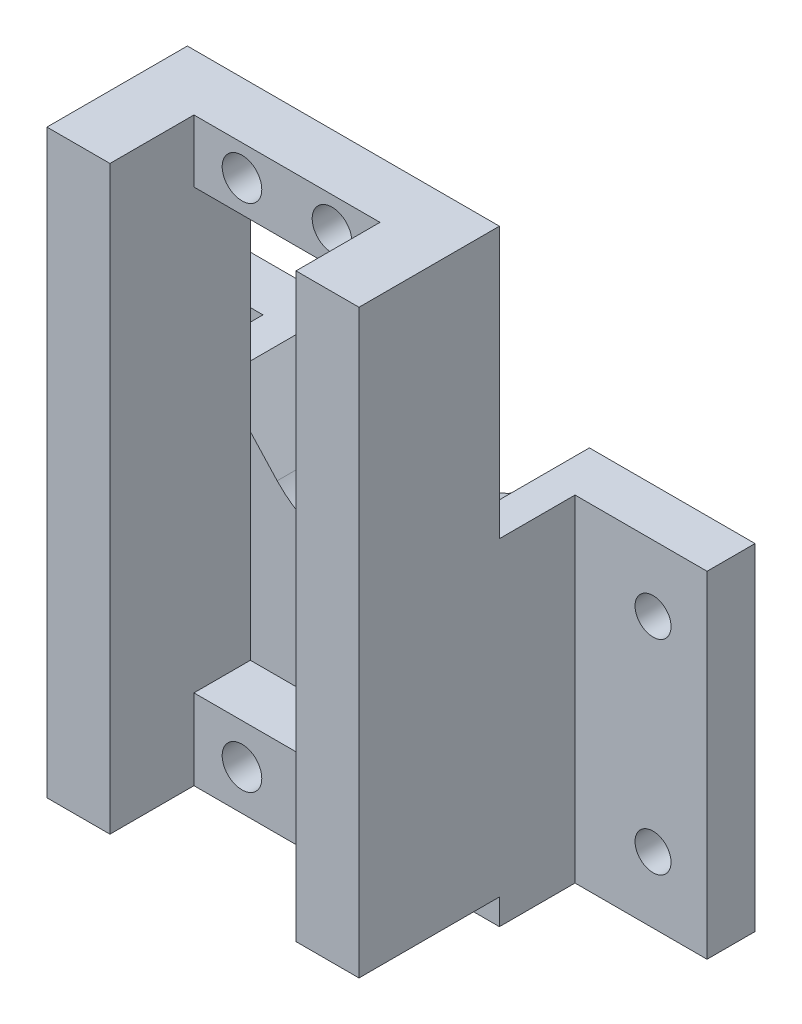
from build123d import *

# Parameters (mm, degrees)
SZKIC1_W                    = 48
SZKIC1_H                    = 28
SZKIC1_R                    = 1.5
DODANIE_WYCI_GNI_CIE1_DEPTH = 4
WYTNIJ_WYCI_GNI_CIE1_DEPTH  = 4
SZKIC3_W                    = 26
SZKIC3_H                    = 6.7
DODANIE_WYCI_GNI_CIE2_DEPTH = 11
DODANIE_WYCI_GNI_CIE3_START = 6.3
DODANIE_WYCI_GNI_CIE3_DEPTH = 6.3
SZKIC5_W                    = 26
SZKIC5_H                    = 2.15
DODANIE_WYCI_GNI_CIE4_DEPTH = 6.3
DODANIE_WYCI_GNI_CIE7_DEPTH = 4.7
WYTNIJ_WYCI_GNI_CIE2_REACH  = 48.227
SZKIC10_R                   = 1.65
DODANIE_WYCI_GNI_CIE8_DEPTH = 7
WYTNIJ_WYCI_GNI_CIE3_DEPTH  = 7


with BuildPart() as part:
    # Szkic1 → Dodanie-wyciągnięcie1 (new body)
    with BuildSketch(Plane.XY):
        Rectangle(SZKIC1_W, SZKIC1_H)
        with Locations((-19.5, 8.5)):
            Circle(SZKIC1_R, mode=Mode.SUBTRACT)
        with Locations((-19.5, -8.5)):
            Circle(SZKIC1_R, mode=Mode.SUBTRACT)
        with Locations((19.5, -8.5)):
            Circle(SZKIC1_R, mode=Mode.SUBTRACT)
        with Locations((19.5, 8.5)):
            Circle(SZKIC1_R, mode=Mode.SUBTRACT)
    extrude(amount=DODANIE_WYCI_GNI_CIE1_DEPTH)

    # Szkic2 → Wytnij-wyciągnięcie1 (cut)
    with BuildSketch(Plane.XY.offset(4)):
        with BuildLine():
            Line((5.516782951, 8.919143195), (10.1961597, 14))
            Line((10.1961597, 14), (-10.1961597, 14))
            Line((-10.1961597, 14), (-5.516782951, 8.919143195))
            ThreePointArc((-5.516782951, 8.919143195), (0, 6.5), (5.516782951, 8.919143195))
        make_face()
    extrude(amount=-WYTNIJ_WYCI_GNI_CIE1_DEPTH, mode=Mode.SUBTRACT)

    # Szkic3 → Dodanie-wyciągnięcie2 (add)
    with BuildSketch(Plane.XY.offset(4)):
        with Locations((0, -8.5)):
            Rectangle(SZKIC3_W, SZKIC3_H)
    extrude(amount=DODANIE_WYCI_GNI_CIE2_DEPTH)

    # Szkic4 → Dodanie-wyciągnięcie3 (add)
    with BuildSketch(Plane.XY.offset(4).offset(DODANIE_WYCI_GNI_CIE3_START)):
        with BuildLine():
            Line((-13, -5.15), (13, -5.15))
            Line((13, -5.15), (13, 14))
            Line((13, 14), (10.1961597, 14))
            Line((10.1961597, 14), (5.516782951, 8.919143195))
            ThreePointArc((5.516782951, 8.919143195), (0, 6.5), (-5.516782951, 8.919143195))
            Line((-5.516782951, 8.919143195), (-10.1961597, 14))
            Line((-10.1961597, 14), (-13, 14))
            Line((-13, 14), (-13, -5.15))
        make_face()
    extrude(amount=-DODANIE_WYCI_GNI_CIE3_DEPTH)

    # Szkic5 → Dodanie-wyciągnięcie4 (add)
    with BuildSketch(Plane.XY.offset(4)):
        with Locations((0, -12.925)):
            Rectangle(SZKIC5_W, SZKIC5_H)
    extrude(amount=DODANIE_WYCI_GNI_CIE4_DEPTH)

    # Szkic9 → Dodanie-wyciągnięcie7 (add)
    with BuildSketch(Plane.XY.offset(10.3)):
        Polygon((-13, -5.15), (-13, 36.55), (13, 36.55), (13, -5.15), (7.75, -5.15), (7.75, 31.35), (-7.75, 31.35), (-7.75, -5.15), align=None)
    extrude(amount=DODANIE_WYCI_GNI_CIE7_DEPTH)

    # Wytnij-wyciągnięcie2: up to this face of the body (flat: up to its plane)
    wytnij_wyci_gni_cie2_end = Plane(part.part.faces().sort_by_distance((0, -0.888373191, 0))[0])
    # Szkic10 → Wytnij-wyciągnięcie2 (cut, up to the picked face)
    with BuildSketch(Plane.XY.offset(15), mode=Mode.PRIVATE) as wytnij_wyci_gni_cie2_sk1:
        with Locations((-3.75, -8.5)):
            Circle(SZKIC10_R)
    wytnij_wyci_gni_cie2_tool1 = split(extrude(wytnij_wyci_gni_cie2_sk1.sketch, amount=-WYTNIJ_WYCI_GNI_CIE2_REACH, mode=Mode.PRIVATE), bisect_by=wytnij_wyci_gni_cie2_end, keep=Keep.BOTH, mode=Mode.PRIVATE)
    # Szkic10 → Wytnij-wyciągnięcie2 (cut, up to the picked face)
    with BuildSketch(Plane.XY.offset(15), mode=Mode.PRIVATE) as wytnij_wyci_gni_cie2_sk2:
        with Locations((3.75, -8.5)):
            Circle(SZKIC10_R)
    wytnij_wyci_gni_cie2_tool2 = split(extrude(wytnij_wyci_gni_cie2_sk2.sketch, amount=-WYTNIJ_WYCI_GNI_CIE2_REACH, mode=Mode.PRIVATE), bisect_by=wytnij_wyci_gni_cie2_end, keep=Keep.BOTH, mode=Mode.PRIVATE)
    # Szkic10 → Wytnij-wyciągnięcie2 (cut, up to the picked face)
    with BuildSketch(Plane.XY.offset(15), mode=Mode.PRIVATE) as wytnij_wyci_gni_cie2_sk3:
        with Locations((-3.75, 34)):
            Circle(SZKIC10_R)
    wytnij_wyci_gni_cie2_tool3 = split(extrude(wytnij_wyci_gni_cie2_sk3.sketch, amount=-WYTNIJ_WYCI_GNI_CIE2_REACH, mode=Mode.PRIVATE), bisect_by=wytnij_wyci_gni_cie2_end, keep=Keep.BOTH, mode=Mode.PRIVATE)
    # Szkic10 → Wytnij-wyciągnięcie2 (cut, up to the picked face)
    with BuildSketch(Plane.XY.offset(15), mode=Mode.PRIVATE) as wytnij_wyci_gni_cie2_sk4:
        with Locations((3.75, 34)):
            Circle(SZKIC10_R)
    wytnij_wyci_gni_cie2_tool4 = split(extrude(wytnij_wyci_gni_cie2_sk4.sketch, amount=-WYTNIJ_WYCI_GNI_CIE2_REACH, mode=Mode.PRIVATE), bisect_by=wytnij_wyci_gni_cie2_end, keep=Keep.BOTH, mode=Mode.PRIVATE)
    add(wytnij_wyci_gni_cie2_tool1.solids().sort_by(Axis((-3.75, -8.5, 15), (0, 0, -1)))[0], mode=Mode.SUBTRACT)
    add(wytnij_wyci_gni_cie2_tool2.solids().sort_by(Axis((3.75, -8.5, 15), (0, 0, -1)))[0], mode=Mode.SUBTRACT)
    add(wytnij_wyci_gni_cie2_tool3.solids().sort_by(Axis((-3.75, 34, 15), (0, 0, -1)))[0], mode=Mode.SUBTRACT)
    add(wytnij_wyci_gni_cie2_tool4.solids().sort_by(Axis((3.75, 34, 15), (0, 0, -1)))[0], mode=Mode.SUBTRACT)

    # Szkic12 → Dodanie-wyciągnięcie8 (add)
    with BuildSketch(Plane.XY.offset(15)):
        Polygon((-7.75, 36.55), (-13, 36.55), (-13, -11.85), (-7.75, -11.85), (-7.75, -5.15), (-7.75, 31.35), align=None)
        Polygon((13, 36.55), (7.75, 36.55), (7.75, 31.35), (7.75, -5.15), (7.75, -11.85), (13, -11.85), align=None)
    extrude(amount=DODANIE_WYCI_GNI_CIE8_DEPTH)

    # Szkic14 → Wytnij-wyciągnięcie3 (cut)
    with BuildSketch(Plane(origin=(0, 0, 0), x_dir=(-1, 0, 0), z_dir=(0, 0, -1))):
        Polygon((-3.75, -4.458548116), (-7.25, -6.479274058), (-7.25, -10.520725942), (-3.75, -12.541451884), (-0.25, -10.520725942), (-0.25, -6.479274058), align=None)
        Polygon((3.75, -4.458548116), (0.25, -6.479274058), (0.25, -10.520725942), (3.75, -12.541451884), (7.25, -10.520725942), (7.25, -6.479274058), align=None)
    extrude(amount=-WYTNIJ_WYCI_GNI_CIE3_DEPTH, mode=Mode.SUBTRACT)


solid = part.part
